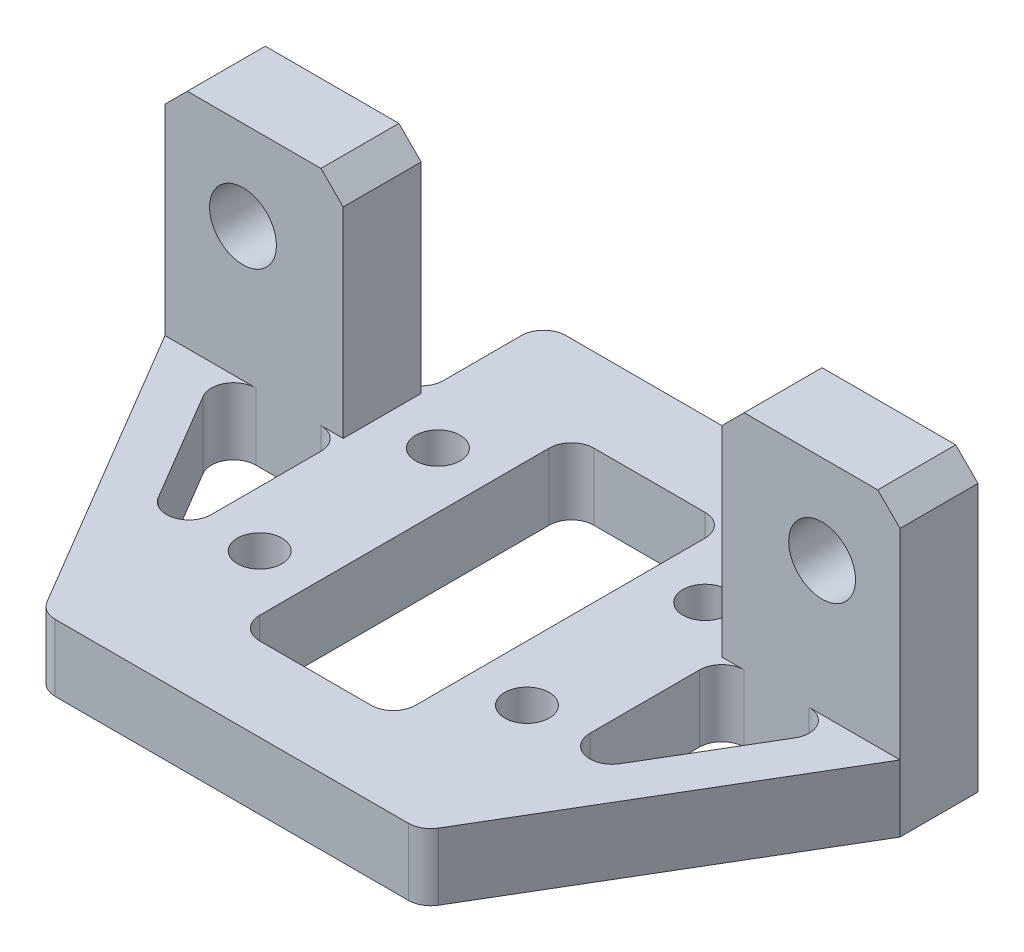
from build123d import *

# Parameters (mm, degrees)
SKETCH_1_W          = 17
SKETCH_1_H          = 22.5
EXTRUDE_1_DEPTH     = 3
EXTRUDE_START       = 5.5
SKETCH_2_W          = 33
SKETCH_2_H          = 13
SKETCH_2_R          = 1.5
EXTRUDE_2_DEPTH     = 3.5
SKETCH_3_R          = 1
CUT_EXTRUDE_1_DEPTH = 24.828816588
SKETCH_4_W          = 17
SKETCH_4_H          = 3.5
CUT_EXTRUDE_2_DEPTH = 10
SKETCH_5_W          = 7
SKETCH_5_H          = 15
CUT_EXTRUDE_3_DEPTH = 23.334110683
EXTRUDE_3_DEPTH     = 3
FILLET_1_R          = 1
FILLET_2_R          = 1
CHAMFER_2_SIZE      = 1


with BuildPart() as part:
    # 草图1 → 凸台-拉伸1 (new body)
    with BuildSketch(Plane(origin=(0, 0, 0), x_dir=(1, 0, 0), z_dir=(0, 1, 0))):
        Rectangle(SKETCH_1_W, SKETCH_1_H)
    extrude(amount=EXTRUDE_1_DEPTH)

    # 草图2 → 凸台-拉伸2 (add)
    with BuildSketch(Plane.XY.offset(-11.25).offset(EXTRUDE_START)):
        with Locations((0, 6.5)):
            Rectangle(SKETCH_2_W, SKETCH_2_H)
        with Locations((-13, 9)):
            Circle(SKETCH_2_R, mode=Mode.SUBTRACT)
        with Locations(Location((13, 9, 0), (0, 0, 180))):
            Circle(SKETCH_2_R, mode=Mode.SUBTRACT)
    extrude(amount=EXTRUDE_2_DEPTH)

    # 草图3 → 切除-拉伸1 (cut, through all)
    with BuildSketch(Plane.XZ):
        with Locations(Location((6, -4, 0), (0, 0, 270))):
            Circle(SKETCH_3_R)
        with Locations(Location((-6, -4, 0), (0, 0, 270))):
            Circle(SKETCH_3_R)
        with Locations(Location((-6, 4, 0), (0, 0, 270))):
            Circle(SKETCH_3_R)
        with Locations(Location((6, 4, 0), (0, 0, 270))):
            Circle(SKETCH_3_R)
    extrude(amount=-CUT_EXTRUDE_1_DEPTH, mode=Mode.SUBTRACT)

    # 草图4 → 切除-拉伸2 (cut)
    with BuildSketch(Plane(origin=(0, 13, 0), x_dir=(1, 0, 0), z_dir=(0, 1, 0))):
        with Locations((0, 4)):
            Rectangle(SKETCH_4_W, SKETCH_4_H)
    extrude(amount=-CUT_EXTRUDE_2_DEPTH, mode=Mode.SUBTRACT)

    # 草图5 → 切除-拉伸3 (cut, through all)
    with BuildSketch(Plane(origin=(0, 3, 0), x_dir=(1, 0, 0), z_dir=(0, 1, 0))):
        Rectangle(SKETCH_5_W, SKETCH_5_H)
    extrude(amount=-CUT_EXTRUDE_3_DEPTH, mode=Mode.SUBTRACT)

    # 草图6 → 凸台-拉伸3 (add)
    with BuildSketch(Plane.XZ):
        Polygon((-16.5, -2.25), (-8.5, 11.25), (-8.5, 7.326911293), (-14.175206692, -2.25), align=None)
        Polygon((14.175206692, -2.25), (8.5, 7.326911293), (8.5, 11.25), (16.5, -2.25), align=None)
    extrude(amount=-EXTRUDE_3_DEPTH)

    # 圆角1
    fillet_1_edges = [part.edges().sort_by_distance(p)[0] for p in [
        (-8.5, 1.5, 7.326911293),
        (-14.175206692, 1.5, -2.25),
        (8.5, 1.5, 7.326911293),
        (14.175206692, 1.5, -2.25),
        (8.5, 1.5, -2.25),
        (-8.5, 1.5, -2.25),
        (3.5, 1.5, -7.5),
        (3.5, 1.5, 7.5),
        (-3.5, 1.5, 7.5),
        (-3.5, 1.5, -7.5),
    ]]
    fillet(fillet_1_edges, radius=FILLET_1_R)

    # 圆角2
    fillet_2_edges = [part.edges().sort_by_distance(p)[0] for p in [
        (8.5, 1.5, -5.75),
        (-8.5, 1.5, -5.75),
        (8.5, 1.5, 11.25),
        (-8.5, 1.5, 11.25),
        (-8.5, 1.5, -11.25),
        (8.5, 1.5, -11.25),
    ]]
    fillet(fillet_2_edges, radius=FILLET_2_R)

    # 倒角2
    chamfer_2_edges = [part.edges().sort_by_distance(p)[0] for p in [
        (16.5, 13, -4),
        (-16.5, 13, -4),
        (8.5, 13, -4),
        (-8.5, 13, -4),
    ]]
    chamfer(chamfer_2_edges, length=CHAMFER_2_SIZE)


solid = part.part
